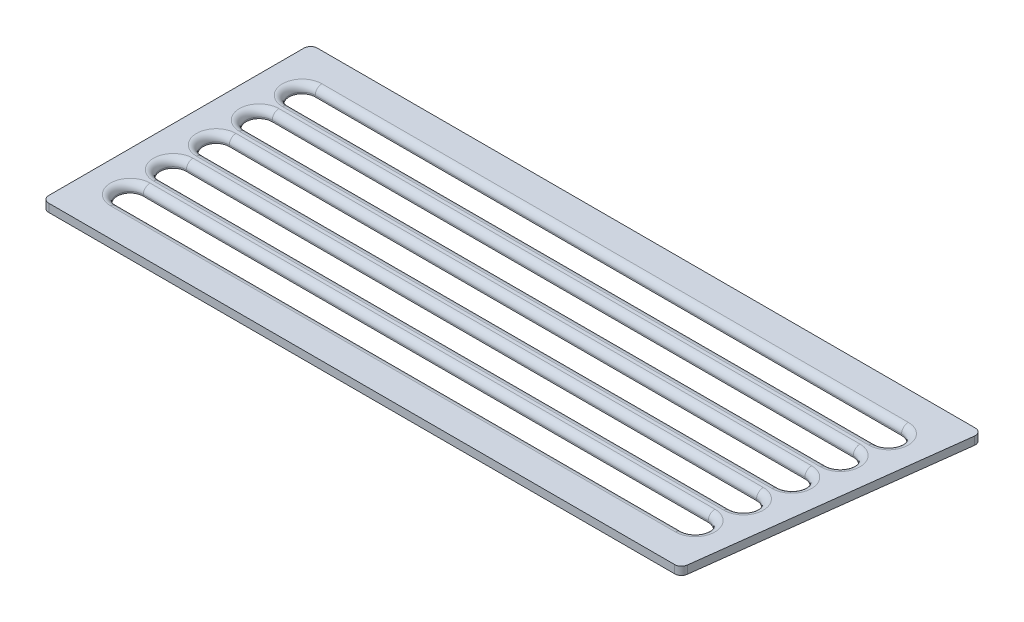
from build123d import *

# Parameters (mm, degrees)
BOSS_EXTRUDE1_DEPTH = 3
CUT_EXTRUDE1_DEPTH  = 270.507073191
FILLET1_R           = 2.5
FILLET3_R           = 2.5


with BuildPart() as part:
    # Sketch11 → Boss-Extrude1 (new body)
    with BuildSketch(Plane(origin=(0, 0, 0), x_dir=(1, 0, 0), z_dir=(0, 1, 0))):
        Polygon((250.25, 100), (0, 100), (0, 0), (237.75, 0), align=None)
    extrude(amount=BOSS_EXTRUDE1_DEPTH)

    # Sketch12 → Cut-Extrude1 (cut, through all)
    with BuildSketch(Plane(origin=(0, 3, 0), x_dir=(1, 0, 0), z_dir=(0, 1, 0))):
        with BuildLine():
            Line((14.85, 38.85), (227.15, 38.85))
            ThreePointArc((227.15, 38.85), (232, 34), (227.15, 29.15))
            Line((227.15, 29.15), (14.85, 29.15))
            ThreePointArc((14.85, 29.15), (10, 34), (14.85, 38.85))
        make_face()
        with BuildLine():
            Line((14.85, 86.85), (233.15, 86.85))
            ThreePointArc((233.15, 86.85), (238, 82), (233.15, 77.15))
            Line((233.15, 77.15), (14.85, 77.15))
            ThreePointArc((14.85, 77.15), (10, 82), (14.85, 86.85))
        make_face()
        with BuildLine():
            Line((14.85, 70.85), (231.15, 70.85))
            ThreePointArc((231.15, 70.85), (236, 66), (231.15, 61.15))
            Line((231.15, 61.15), (14.85, 61.15))
            ThreePointArc((14.85, 61.15), (10, 66), (14.85, 70.85))
        make_face()
        with BuildLine():
            Line((14.85, 13.15), (225.15, 13.15))
            ThreePointArc((225.15, 13.15), (230, 18), (225.15, 22.85))
            Line((225.15, 22.85), (14.85, 22.85))
            ThreePointArc((14.85, 22.85), (10, 18), (14.85, 13.15))
        make_face()
        with BuildLine():
            Line((14.85, 54.85), (229.15, 54.85))
            ThreePointArc((229.15, 54.85), (234, 50), (229.15, 45.15))
            Line((229.15, 45.15), (14.85, 45.15))
            ThreePointArc((14.85, 45.15), (10, 50), (14.85, 54.85))
        make_face()
    extrude(amount=-CUT_EXTRUDE1_DEPTH, mode=Mode.SUBTRACT)

    # Fillet1
    fillet1_edges = [part.edges().sort_by_distance(p)[0] for p in [
        (10, 3, -50),
        (122, 3, -45.15),
        (234, 3, -50),
        (122, 3, -54.85),
        (10, 3, -18),
        (120, 3, -13.15),
        (230, 3, -18),
        (120, 3, -22.85),
        (10, 3, -66),
        (123, 3, -61.15),
        (236, 3, -66),
        (123, 3, -70.85),
        (10, 3, -82),
        (124, 3, -77.15),
        (238, 3, -82),
        (124, 3, -86.85),
        (10, 3, -34),
        (121, 3, -29.15),
        (232, 3, -34),
        (121, 3, -38.85),
    ]]
    fillet(fillet1_edges, radius=FILLET1_R)

    # Fillet3
    fillet3_edges = [part.edges().sort_by_distance(p)[0] for p in [
        (237.75, 1.5, 0),
        (0, 1.5, 0),
        (0, 1.5, -100),
        (250.25, 1.5, -100),
    ]]
    fillet(fillet3_edges, radius=FILLET3_R)


solid = part.part
